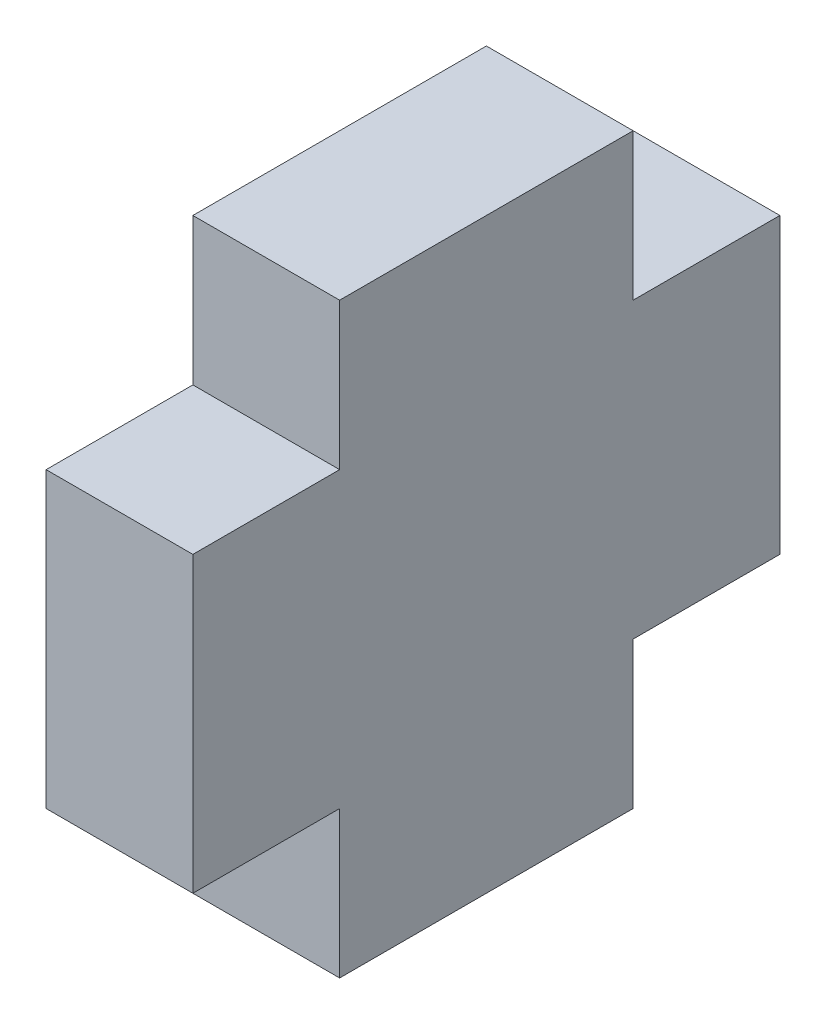
from build123d import *

# Parameters (mm, degrees)
BOSS_EXTRUDE1_DEPTH = 10


with BuildPart() as part:
    # Sketch1 → Boss-Extrude1 (new body)
    with BuildSketch(Plane(origin=(0, 0, 0), x_dir=(0, 0, -1), z_dir=(1, 0, 0))):
        Polygon((10, 20), (-10, 20), (-10, 10), (-20, 10), (-20, -10), (-10, -10), (-10, -20), (10, -20), (10, -10), (20, -10), (20, 10), (10, 10), align=None)
    extrude(amount=BOSS_EXTRUDE1_DEPTH)


solid = part.part
